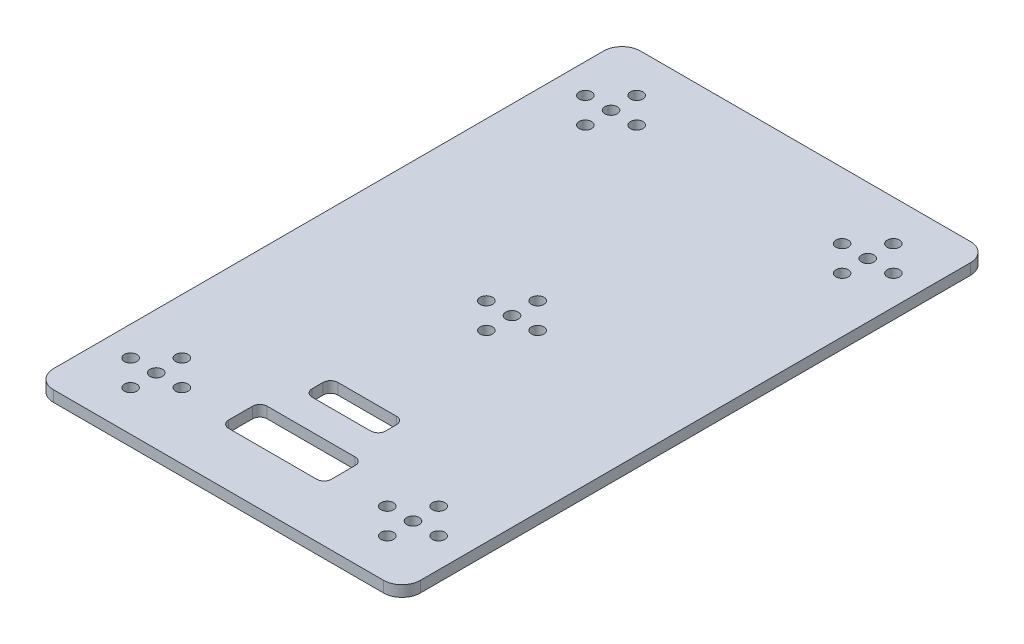
from build123d import *

# Parameters (mm, degrees)
SKETCH1_W            = 100
SKETCH1_H            = 160
BOSS_EXTRUDE1_DEPTH  = 3
M3_CLEARANCE_HOLE1_D = 3.4
M3_CLEARANCE_HOLE2_D = 3.4
CUT_EXTRUDE1_REACH   = 96.387
SKETCH6_W            = 28
SKETCH6_H            = 10.5
SKETCH6_W_2          = 20
SKETCH6_H_2          = 7
FILLET1_R            = 5
FILLET2_R            = 2


with BuildPart() as part:
    # Sketch1 → Boss-Extrude1 (new body)
    with BuildSketch(Plane(origin=(0, 0, 0), x_dir=(1, 0, 0), z_dir=(0, 1, 0))):
        Rectangle(SKETCH1_W, SKETCH1_H)
    extrude(amount=BOSS_EXTRUDE1_DEPTH)

    # M3 Clearance Hole1 (through all)
    with Locations(Plane(origin=(0, 3, 0), x_dir=(1, 0, 0), z_dir=(0, 1, 0))):
        with Locations((-35, 62), (-35, 69), (-42, 62), (-35, 55), (-28, 62), (35, 69), (28, 62), (35, 62), (42, 62), (35, 55), (-35, -62), (-42, -62), (-35, -55), (-28, -62), (-35, -69), (35, -62), (35, -55), (28, -62), (42, -62), (35, -69)):
            Hole(M3_CLEARANCE_HOLE1_D / 2)

    # M3 Clearance Hole2 (through all)
    with Locations(Plane(origin=(0, 3, 0), x_dir=(1, 0, 0), z_dir=(0, 1, 0))):
        with Locations((0, 0), (0, 7), (7, 0), (0, -7), (-7, 0)):
            Hole(M3_CLEARANCE_HOLE2_D / 2)

    # Sketch6 → Cut-Extrude1 (cut, up to next)
    with BuildSketch(Plane(origin=(0, 3, 0), x_dir=(1, 0, 0), z_dir=(0, 1, 0)), mode=Mode.PRIVATE) as cut_extrude1_sk1:
        with Locations((0, -60)):
            Rectangle(SKETCH6_W, SKETCH6_H)
    cut_extrude1_tool1 = extrude(cut_extrude1_sk1.sketch, amount=-CUT_EXTRUDE1_REACH, mode=Mode.PRIVATE) & part.part
    # Sketch6 → Cut-Extrude1 (cut, up to next)
    with BuildSketch(Plane(origin=(0, 3, 0), x_dir=(1, 0, 0), z_dir=(0, 1, 0)), mode=Mode.PRIVATE) as cut_extrude1_sk2:
        with Locations((0, -43)):
            Rectangle(SKETCH6_W_2, SKETCH6_H_2)
    cut_extrude1_tool2 = extrude(cut_extrude1_sk2.sketch, amount=-CUT_EXTRUDE1_REACH, mode=Mode.PRIVATE) & part.part
    add(cut_extrude1_tool1.solids().sort_by_distance((0, 3, 60))[0], mode=Mode.SUBTRACT)
    add(cut_extrude1_tool2.solids().sort_by_distance((0, 3, 43))[0], mode=Mode.SUBTRACT)

    # Fillet1
    fillet1_edges = [part.edges().sort_by_distance(p)[0] for p in [
        (50, 1.5, 80),
        (-50, 1.5, 80),
        (-50, 1.5, -80),
        (50, 1.5, -80),
    ]]
    fillet(fillet1_edges, radius=FILLET1_R)

    # Fillet2
    fillet2_edges = [part.edges().sort_by_distance(p)[0] for p in [
        (-14, 1.5, 65.25),
        (-14, 1.5, 54.75),
        (14, 1.5, 54.75),
        (14, 1.5, 65.25),
        (10, 1.5, 39.5),
        (10, 1.5, 46.5),
        (-10, 1.5, 46.5),
        (-10, 1.5, 39.5),
    ]]
    fillet(fillet2_edges, radius=FILLET2_R)


solid = part.part
